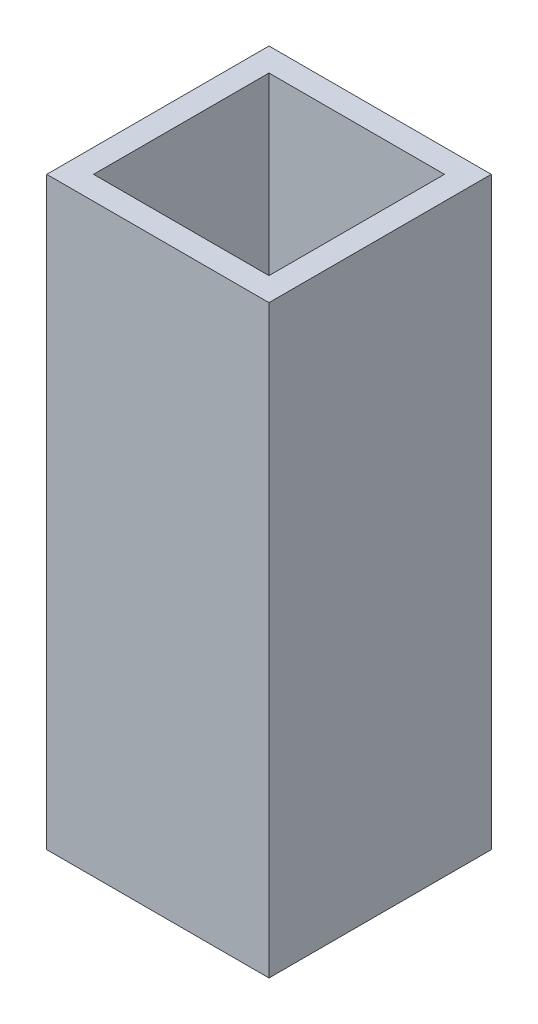
from build123d import *

# Parameters (mm, degrees)
SKETCH1_W           = 19
SKETCH1_H           = 19
SKETCH1_W_2         = 15
SKETCH1_H_2         = 15
EXTRUDE_THIN1_DEPTH = 50


with BuildPart() as part:
    # Sketch1 → Extrude-Thin1 (new body)
    with BuildSketch(Plane(origin=(0, 0, 0), x_dir=(1, 0, 0), z_dir=(0, 1, 0))):
        Rectangle(SKETCH1_W, SKETCH1_H)
        Rectangle(SKETCH1_W_2, SKETCH1_H_2, mode=Mode.SUBTRACT)
    extrude(amount=EXTRUDE_THIN1_DEPTH)


solid = part.part
